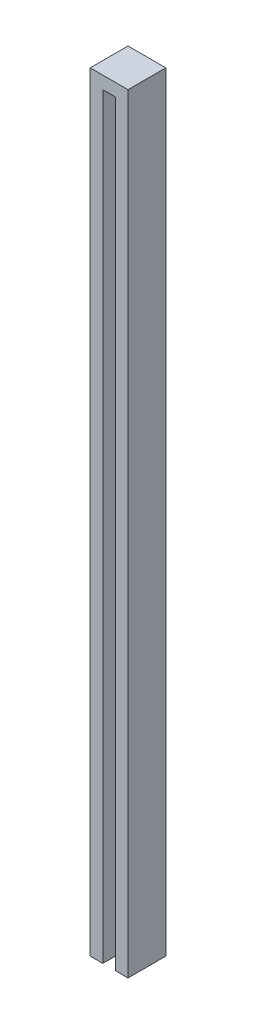
from build123d import *

# Parameters (mm, degrees)
SKETCH1_W           = 150
SKETCH1_H           = 150
BOSS_EXTRUDE1_DEPTH = 3050
SKETCH2_W           = 50
SKETCH2_H           = 50
CUT_EXTRUDE1_DEPTH  = 3000
SKETCH3_R           = 10
CUT_EXTRUDE2_DEPTH  = 10


with BuildPart() as part:
    # Sketch1 → Boss-Extrude1 (new body)
    with BuildSketch(Plane(origin=(0, 0, 0), x_dir=(1, 0, 0), z_dir=(0, 1, 0))):
        Rectangle(SKETCH1_W, SKETCH1_H)
    extrude(amount=BOSS_EXTRUDE1_DEPTH)

    # Sketch2 → Cut-Extrude1 (cut)
    with BuildSketch(Plane.XZ):
        with Locations((0, 50)):
            Rectangle(SKETCH2_W, SKETCH2_H)
        with Locations((0, -50)):
            Rectangle(SKETCH2_W, SKETCH2_H)
    extrude(amount=-CUT_EXTRUDE1_DEPTH, mode=Mode.SUBTRACT)

    # Sketch3 → Cut-Extrude2 (cut)
    with BuildSketch(Plane.XZ):
        with Locations(Location((-50, 50, 0), (0, 0, 270))):
            Circle(SKETCH3_R)
        with Locations(Location((50, 50, 0), (0, 0, 90))):
            Circle(SKETCH3_R)
        with Locations(Location((50, -50, 0), (0, 0, 270))):
            Circle(SKETCH3_R)
        with Locations(Location((-50, -50, 0), (0, 0, 90))):
            Circle(SKETCH3_R)
    extrude(amount=-CUT_EXTRUDE2_DEPTH, mode=Mode.SUBTRACT)


solid = part.part
